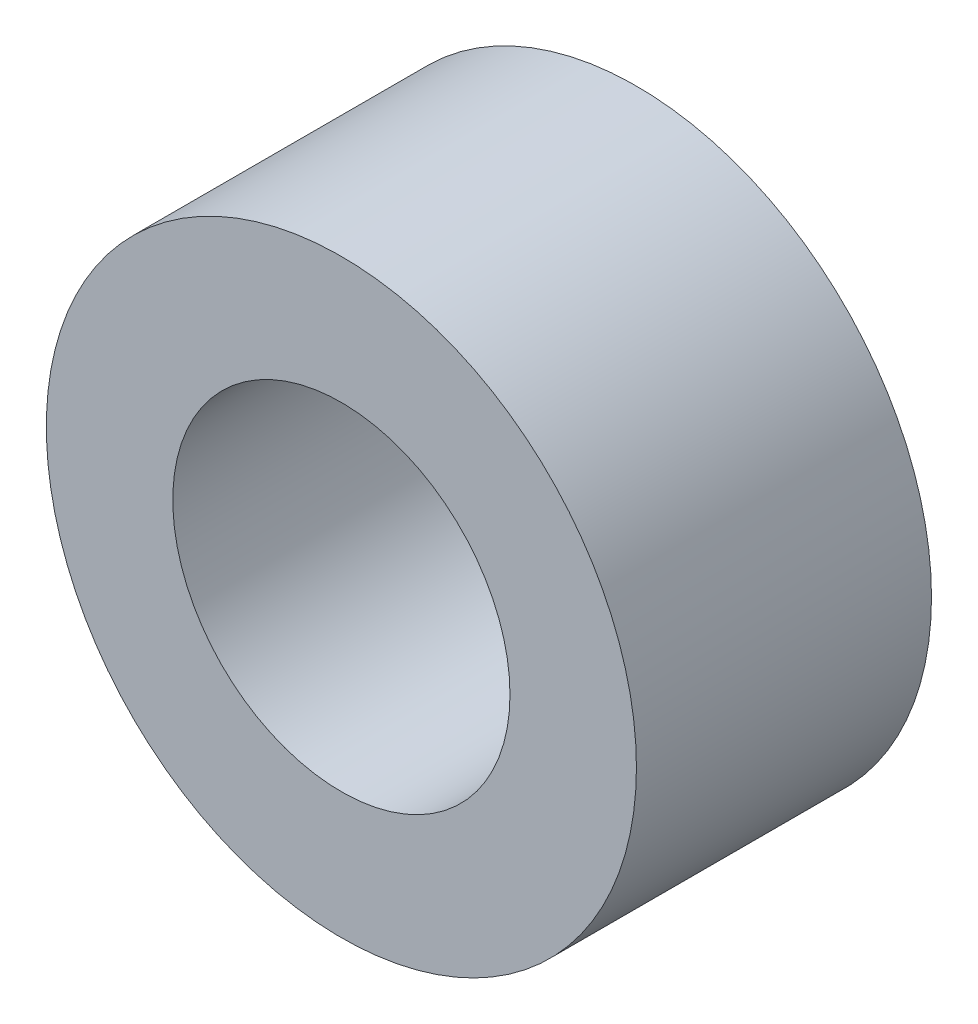
from build123d import *

# Parameters (mm, degrees)
SKETCH_1_R      = 35
SKETCH_1_R_2    = 20
EXTRUDE_1_DEPTH = 35


with BuildPart() as part:
    # 草图1 → 凸台-拉伸1 (new body)
    with BuildSketch(Plane.XY):
        Circle(SKETCH_1_R)
        Circle(SKETCH_1_R_2, mode=Mode.SUBTRACT)
    extrude(amount=EXTRUDE_1_DEPTH)


solid = part.part
